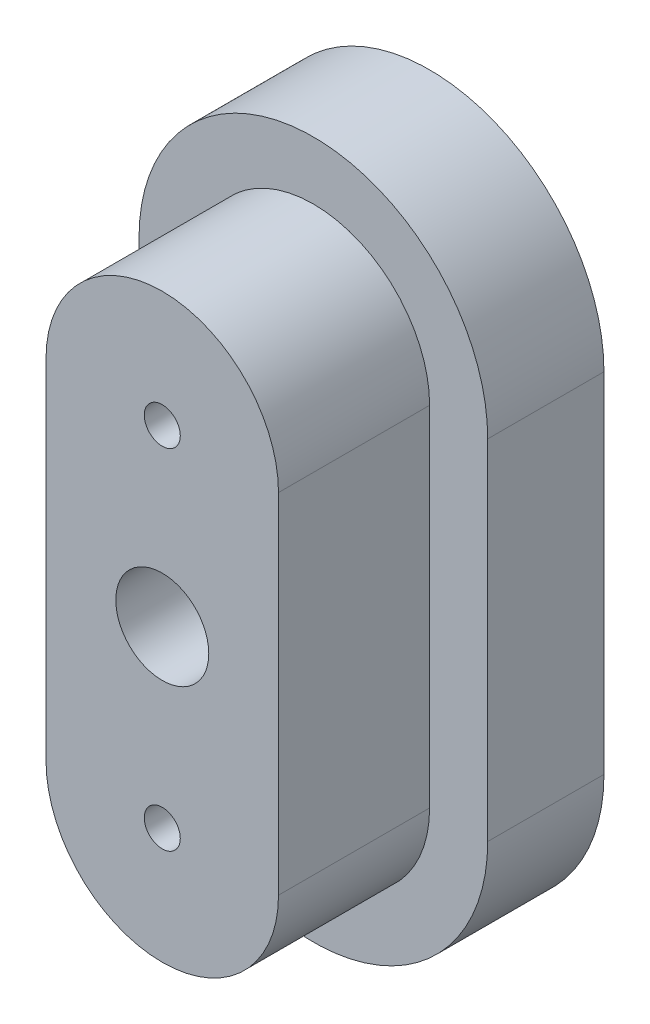
from build123d import *

# Parameters (mm, degrees)
BOSS_EXTRUDE1_DEPTH     = 23
SKETCH2_R               = 1.55
CUT_EXTRUDE1_DEPTH      = 30
BOSS_EXTRUDE2_DEPTH     = 10
SKETCH5_R               = 4
CUT_EXTRUDE3_DEPTH      = 70
ESQUISSE1_R             = 4.15
ENL_V_MAT_EXTRU_1_DEPTH = 3


with BuildPart() as part:
    # Sketch1 → Boss-Extrude1 (new body)
    with BuildSketch(Plane.XY):
        with BuildLine():
            Line((-10, -4.786331479), (-10, 25.213668521))
            ThreePointArc((-10, 25.213668521), (0, 35.213668521), (10, 25.213668521))
            Line((10, 25.213668521), (10, -4.786331479))
            ThreePointArc((10, -4.786331479), (0, -14.786331479), (-10, -4.786331479))
        make_face()
    extrude(amount=BOSS_EXTRUDE1_DEPTH)

    # Sketch2 → Cut-Extrude1 (cut)
    with BuildSketch(Plane.XY.offset(23)):
        with Locations((0, 25.213668521)):
            Circle(SKETCH2_R)
        with Locations((0, -4.786331479)):
            Circle(SKETCH2_R)
    extrude(amount=-CUT_EXTRUDE1_DEPTH, mode=Mode.SUBTRACT)

    # Sketch3 → Boss-Extrude2 (add)
    with BuildSketch(Plane(origin=(0, 0, 0), x_dir=(-1, 0, 0), z_dir=(0, 0, -1))):
        with BuildLine():
            Line((-15, 25.213668521), (-15, -4.786331479))
            ThreePointArc((-15, -4.786331479), (0, -19.786331479), (15, -4.786331479))
            Line((15, -4.786331479), (15, 25.213668521))
            ThreePointArc((15, 25.213668521), (0, 40.213668521), (-15, 25.213668521))
        make_face()
        with BuildLine():
            Line((-10, 25.213668521), (-10, -4.786331479))
            ThreePointArc((-10, -4.786331479), (0, -14.786331479), (10, -4.786331479))
            Line((10, -4.786331479), (10, 25.213668521))
            ThreePointArc((10, 25.213668521), (0, 35.213668521), (-10, 25.213668521))
        make_face(mode=Mode.SUBTRACT)
    extrude(amount=-BOSS_EXTRUDE2_DEPTH)

    # Sketch5 → Cut-Extrude3 (cut)
    with BuildSketch(Plane.XY.offset(23)):
        with Locations((0, 10.213668521)):
            Circle(SKETCH5_R)
    extrude(amount=-CUT_EXTRUDE3_DEPTH, mode=Mode.SUBTRACT)

    # Esquisse1 → Enlèv. mat.-Extru.1 (cut)
    with BuildSketch(Plane(origin=(0, 0, 0), x_dir=(-1, 0, 0), z_dir=(0, 0, -1))):
        with Locations((0, 25.213668521)):
            Circle(ESQUISSE1_R)
        with Locations((0, -4.786331479)):
            Circle(ESQUISSE1_R)
    extrude(amount=-ENL_V_MAT_EXTRU_1_DEPTH, mode=Mode.SUBTRACT)


solid = part.part
